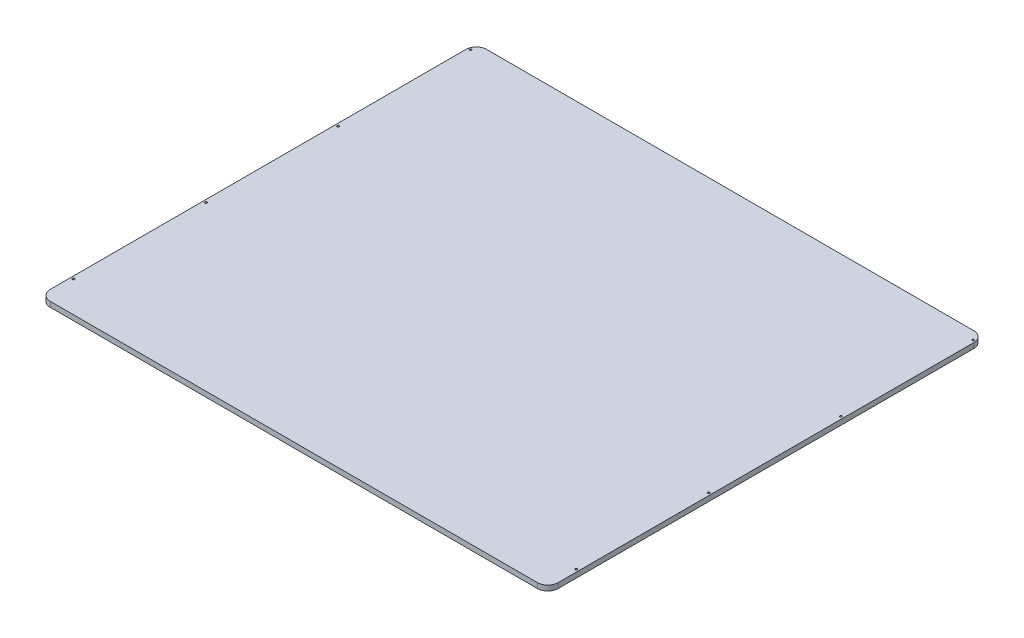
from build123d import *

# Parameters (mm, degrees)
SKETCH1_W           = 490
SKETCH1_H           = 421
BOSS_EXTRUDE1_DEPTH = 5
FILLET1_R           = 10
LPATTERN2_COUNT     = 4
LPATTERN2_PITCH     = 127.67


with BuildPart() as part:
    # Sketch1 → Boss-Extrude1 (new body)
    with BuildSketch(Plane(origin=(0, 0, 0), x_dir=(1, 0, 0), z_dir=(0, 1, 0))):
        Rectangle(SKETCH1_W, SKETCH1_H)
    extrude(amount=BOSS_EXTRUDE1_DEPTH)

    # Fillet1
    fillet1_edges = [part.edges().sort_by_distance(p)[0] for p in [
        (-245, 2.5, -210.5),
        (245, 2.5, -210.5),
        (245, 2.5, 210.5),
        (-245, 2.5, 210.5),
    ]]
    fillet(fillet1_edges, radius=FILLET1_R)

    # Sketch4 → Tap Drill for M2.5x0.45 Tap1 (revolve, cut)
    with BuildSketch(Plane(origin=(-242.5, 0, 180.5), x_dir=(0, 0, -1), z_dir=(1, 0, 0))):
        Polygon((0, 0), (0, 5.615882135), (1.025, 5), (1.025, 0), align=None)
    tap_drill_for_m2_5x0_45_tap1 = revolve(axis=Axis((-242.5, -6.35, 180.5), (0, 1, 0)), mode=Mode.SUBTRACT)

    # LPattern2: Tap Drill for M2.5x0.45 Tap1 ×4
    with Locations(*[(0, 0, -i * LPATTERN2_PITCH) for i in range(1, LPATTERN2_COUNT)]):
        add(tap_drill_for_m2_5x0_45_tap1, mode=Mode.SUBTRACT)

    # Mirror2: Tap Drill for M2.5x0.45 Tap1 across plane
    add(tap_drill_for_m2_5x0_45_tap1.mirror(Plane(origin=(0, 0, 0), x_dir=(0, 0, 1), z_dir=(1, 0, 0))), mode=Mode.SUBTRACT)

    # Mirror2 copy 1 sketch → Mirror2 copy 1 (revolve, cut)
    with BuildSketch(Plane(origin=(242.5, 0, 52.83), x_dir=(0, 0, -1), z_dir=(-1, 0, 0))):
        Polygon((0, 0), (0, -5.615882135), (1.025, -5), (1.025, 0), align=None)
    revolve(axis=Axis((242.5, -6.35, 52.83), (0, -1, 0)), mode=Mode.SUBTRACT)

    # Mirror2 copy 2 sketch → Mirror2 copy 2 (revolve, cut)
    with BuildSketch(Plane(origin=(242.5, 0, -74.84), x_dir=(0, 0, -1), z_dir=(-1, 0, 0))):
        Polygon((0, 0), (0, -5.615882135), (1.025, -5), (1.025, 0), align=None)
    revolve(axis=Axis((242.5, -6.35, -74.84), (0, -1, 0)), mode=Mode.SUBTRACT)

    # Mirror2 copy 3 sketch → Mirror2 copy 3 (revolve, cut)
    with BuildSketch(Plane(origin=(242.5, 0, -202.51), x_dir=(0, 0, -1), z_dir=(-1, 0, 0))):
        Polygon((0, 0), (0, -5.615882135), (1.025, -5), (1.025, 0), align=None)
    revolve(axis=Axis((242.5, -6.35, -202.51), (0, -1, 0)), mode=Mode.SUBTRACT)


solid = part.part
